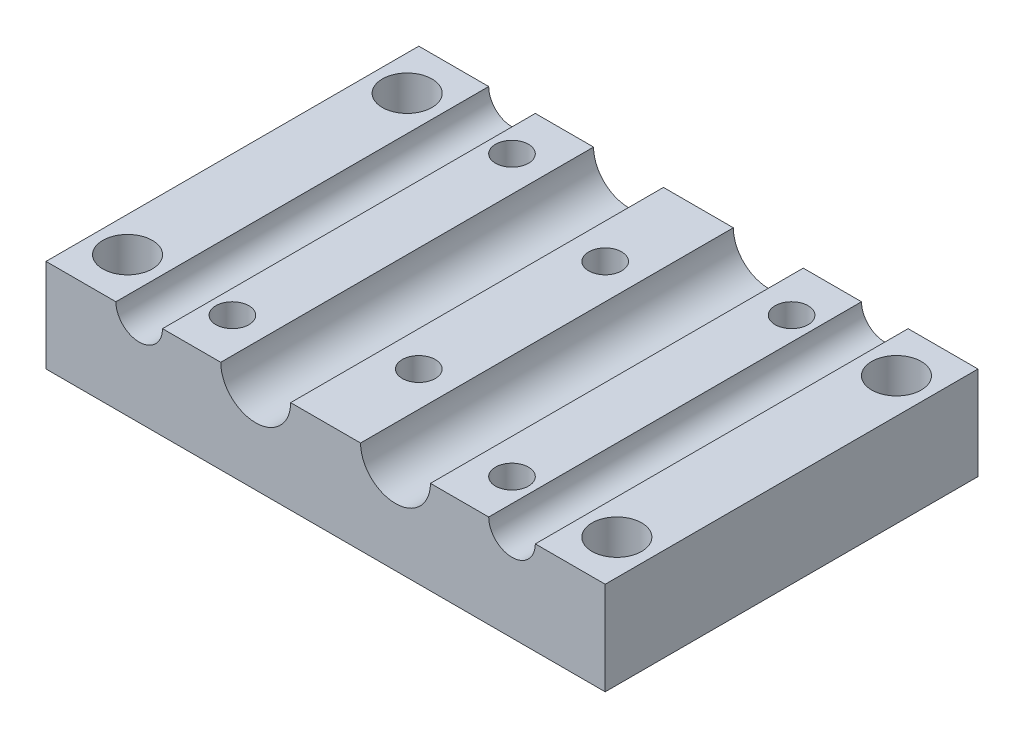
from build123d import *

# Parameters (mm, degrees)
SKETCH1_W               = 76.2
SKETCH1_H               = 50.8
BOSS_EXTRUDE1_DEPTH     = 12.7
SKETCH2_R               = 3.175
CUT_EXTRUDE1_DEPTH      = 65.757547823
SKETCH3_R               = 4.7625
CUT_EXTRUDE2_DEPTH      = 65.757547823
F_1_4_CLEARANCE_HOLE1_D = 6.7564
F_8_CLEARANCE_HOLE1_D   = 4.4958
SKETCH8_R               = 6.096
CUT_EXTRUDE3_DEPTH      = 3.175


with BuildPart() as part:
    # Sketch1 → Boss-Extrude1 (new body)
    with BuildSketch(Plane(origin=(0, 0, 0), x_dir=(1, 0, 0), z_dir=(0, 1, 0))):
        Rectangle(SKETCH1_W, SKETCH1_H)
    extrude(amount=BOSS_EXTRUDE1_DEPTH)

    # Sketch2 → Cut-Extrude1 (cut, through all)
    with BuildSketch(Plane.XY.offset(25.4)):
        with Locations((-25.4, 12.7)):
            Circle(SKETCH2_R)
        with Locations((25.4, 12.7)):
            Circle(SKETCH2_R)
    extrude(amount=-CUT_EXTRUDE1_DEPTH, mode=Mode.SUBTRACT)

    # Sketch3 → Cut-Extrude2 (cut, through all)
    with BuildSketch(Plane.XY.offset(25.4)):
        with Locations((-9.525, 12.7)):
            Circle(SKETCH3_R)
        with Locations((9.525, 12.7)):
            Circle(SKETCH3_R)
    extrude(amount=-CUT_EXTRUDE2_DEPTH, mode=Mode.SUBTRACT)

    # 1/4 Clearance Hole1 (through all)
    with Locations(Plane(origin=(0, 12.7, 0), x_dir=(1, 0, 0), z_dir=(0, 1, 0))):
        with Locations((-33.3375, -19.05), (-33.3375, 19.05), (33.3375, 19.05), (33.3375, -19.05)):
            Hole(F_1_4_CLEARANCE_HOLE1_D / 2)

    # #8 Clearance Hole1 (through all)
    with Locations(Plane(origin=(0, 12.7, 0), x_dir=(1, 0, 0), z_dir=(0, 1, 0))):
        with Locations((-19.05, -19.05), (-19.05, 19.05), (0, 12.7), (0, -12.7), (19.05, -19.05), (19.05, 19.05)):
            Hole(F_8_CLEARANCE_HOLE1_D / 2)

    # Sketch8 → Cut-Extrude3 (cut)
    with BuildSketch(Plane.XZ):
        with Locations(Location((-19.05, 19.05, 0), (0, 0, 270))):
            Circle(SKETCH8_R)
        with Locations(Location((0, 12.7, 0), (0, 0, 270))):
            Circle(SKETCH8_R)
        with Locations(Location((19.05, 19.05, 0), (0, 0, 270))):
            Circle(SKETCH8_R)
        with Locations(Location((19.05, -19.05, 0), (0, 0, 270))):
            Circle(SKETCH8_R)
        with Locations(Location((-19.05, -19.05, 0), (0, 0, 270))):
            Circle(SKETCH8_R)
        with Locations(Location((0, -12.7, 0), (0, 0, 270))):
            Circle(SKETCH8_R)
    extrude(amount=-CUT_EXTRUDE3_DEPTH, mode=Mode.SUBTRACT)


solid = part.part
